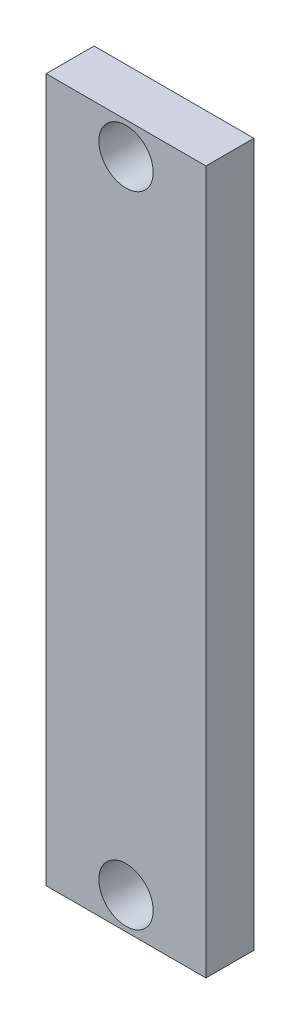
from build123d import *

# Parameters (mm, degrees)
SKETCH1_W      = 10
SKETCH1_H      = 44
BAR_DEPTH      = 3
SKETCH2_R      = 1.7
M3_HOLES_DEPTH = 5


with BuildPart() as part:
    # Sketch1 → Bar (new body)
    with BuildSketch(Plane.XY.offset(87)):
        with Locations((0, 42)):
            Rectangle(SKETCH1_W, SKETCH1_H)
    extrude(amount=BAR_DEPTH)

    # Sketch2 → M3_holes (cut)
    with BuildSketch(Plane.XY.offset(86)):
        with Locations((0, 62)):
            Circle(SKETCH2_R)
        with Locations((0, 22)):
            Circle(SKETCH2_R)
    extrude(amount=M3_HOLES_DEPTH, mode=Mode.SUBTRACT)


solid = part.part
